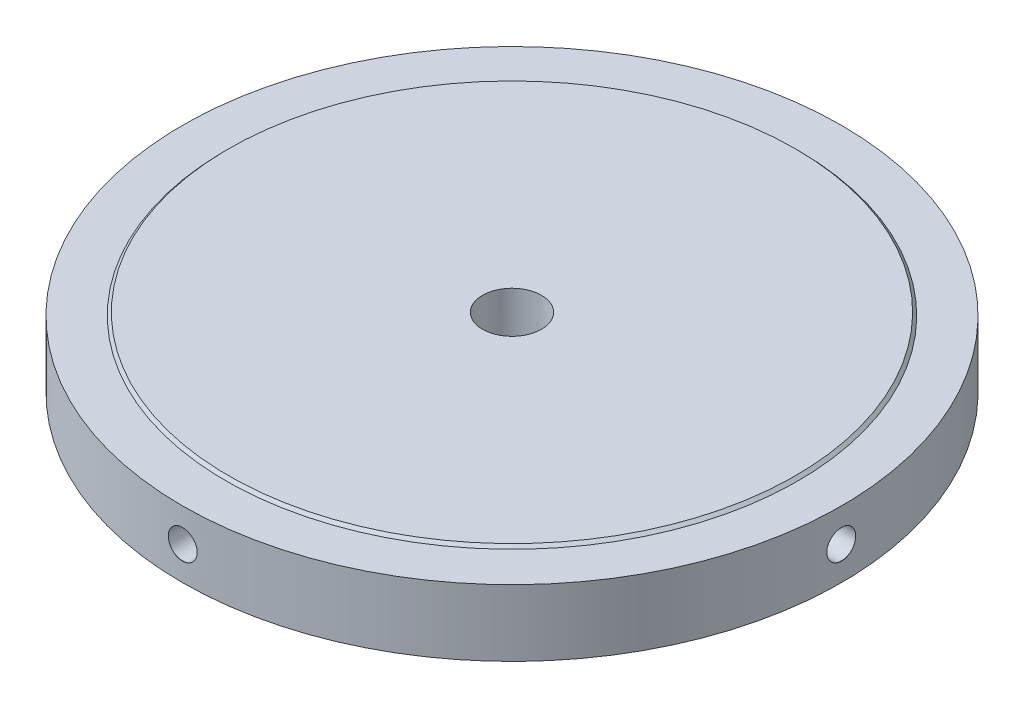
from build123d import *

# Parameters (mm, degrees)
F_5_0MM_DOWEL_HOLE1_D                     = 5
F_5_0MM_DOWEL_HOLE1_DEPTH                 = 12
F_5_0MM_DOWEL_HOLE1_CSINK_D               = 5.05
F_5_0MM_DOWEL_HOLE1_CSINK_ANGLE           = 90
F_5_0MM_DOWEL_HOLE1_TIP                   = 1.502151548
F_5_0MM_DOWEL_HOLE1_ON_FACE_2_D           = 5
F_5_0MM_DOWEL_HOLE1_ON_FACE_2_DEPTH       = 12
F_5_0MM_DOWEL_HOLE1_ON_FACE_2_CSINK_D     = 5.05
F_5_0MM_DOWEL_HOLE1_ON_FACE_2_CSINK_ANGLE = 90
F_5_0MM_DOWEL_HOLE1_ON_FACE_2_TIP         = 1.502151548
F_5_0MM_DOWEL_HOLE1_ON_FACE_3_D           = 5
F_5_0MM_DOWEL_HOLE1_ON_FACE_3_DEPTH       = 12
F_5_0MM_DOWEL_HOLE1_ON_FACE_3_CSINK_D     = 5.05
F_5_0MM_DOWEL_HOLE1_ON_FACE_3_CSINK_ANGLE = 90
F_5_0MM_DOWEL_HOLE1_ON_FACE_3_TIP         = 1.502151548
F_5_0MM_DOWEL_HOLE1_ON_FACE_4_D           = 5
F_5_0MM_DOWEL_HOLE1_ON_FACE_4_DEPTH       = 12
F_5_0MM_DOWEL_HOLE1_ON_FACE_4_CSINK_D     = 5.05
F_5_0MM_DOWEL_HOLE1_ON_FACE_4_CSINK_ANGLE = 90
F_5_0MM_DOWEL_HOLE1_ON_FACE_4_TIP         = 1.502151548
M12_TAPPED_HOLE1_D                        = 10.2


with BuildPart() as part:
    # Sketch1 → Revolve1 (revolve)
    with BuildSketch(Plane.XY, mode=Mode.PRIVATE) as revolve1_sk:
        Polygon((0, 6.25), (49, 6.25), (49.5, 5.75), (57, 5.75), (57, -5.75), (0, -5.75), align=None)
    revolve(revolve1_sk.sketch.rotate(Axis((0, 0, 0), (0, 1, 0)), 90), axis=Axis((0, 0, 0), (0, 1, 0)))

    # Ø5.0mm Dowel Hole1
    with Locations(Plane(origin=(57, 0, 0), x_dir=(0, 0, 1), z_dir=(1, 0, 0))):
        with Locations((0, 0)):
            CounterSinkHole(F_5_0MM_DOWEL_HOLE1_D / 2, F_5_0MM_DOWEL_HOLE1_CSINK_D / 2, depth=F_5_0MM_DOWEL_HOLE1_DEPTH, counter_sink_angle=F_5_0MM_DOWEL_HOLE1_CSINK_ANGLE)
            with Locations((0, 0, -(F_5_0MM_DOWEL_HOLE1_DEPTH + F_5_0MM_DOWEL_HOLE1_TIP / 2))):  # 118° drill point
                Cone(0, F_5_0MM_DOWEL_HOLE1_D / 2, F_5_0MM_DOWEL_HOLE1_TIP, mode=Mode.SUBTRACT)

    # Ø5.0mm Dowel Hole1 on face 2
    with Locations(Plane.XY.offset(57)):
        with Locations((0, 0)):
            CounterSinkHole(F_5_0MM_DOWEL_HOLE1_ON_FACE_2_D / 2, F_5_0MM_DOWEL_HOLE1_ON_FACE_2_CSINK_D / 2, depth=F_5_0MM_DOWEL_HOLE1_ON_FACE_2_DEPTH, counter_sink_angle=F_5_0MM_DOWEL_HOLE1_ON_FACE_2_CSINK_ANGLE)
            with Locations((0, 0, -(F_5_0MM_DOWEL_HOLE1_ON_FACE_2_DEPTH + F_5_0MM_DOWEL_HOLE1_ON_FACE_2_TIP / 2))):  # 118° drill point
                Cone(0, F_5_0MM_DOWEL_HOLE1_ON_FACE_2_D / 2, F_5_0MM_DOWEL_HOLE1_ON_FACE_2_TIP, mode=Mode.SUBTRACT)

    # Ø5.0mm Dowel Hole1 on face 3
    with Locations(Plane(origin=(-57, 0, 0), x_dir=(0, 0, -1), z_dir=(-1, 0, 0))):
        with Locations((0, 0)):
            CounterSinkHole(F_5_0MM_DOWEL_HOLE1_ON_FACE_3_D / 2, F_5_0MM_DOWEL_HOLE1_ON_FACE_3_CSINK_D / 2, depth=F_5_0MM_DOWEL_HOLE1_ON_FACE_3_DEPTH, counter_sink_angle=F_5_0MM_DOWEL_HOLE1_ON_FACE_3_CSINK_ANGLE)
            with Locations((0, 0, -(F_5_0MM_DOWEL_HOLE1_ON_FACE_3_DEPTH + F_5_0MM_DOWEL_HOLE1_ON_FACE_3_TIP / 2))):  # 118° drill point
                Cone(0, F_5_0MM_DOWEL_HOLE1_ON_FACE_3_D / 2, F_5_0MM_DOWEL_HOLE1_ON_FACE_3_TIP, mode=Mode.SUBTRACT)

    # Ø5.0mm Dowel Hole1 on face 4
    with Locations(Plane(origin=(0, 0, -57), x_dir=(-1, 0, 0), z_dir=(0, 0, -1))):
        with Locations((0, 0)):
            CounterSinkHole(F_5_0MM_DOWEL_HOLE1_ON_FACE_4_D / 2, F_5_0MM_DOWEL_HOLE1_ON_FACE_4_CSINK_D / 2, depth=F_5_0MM_DOWEL_HOLE1_ON_FACE_4_DEPTH, counter_sink_angle=F_5_0MM_DOWEL_HOLE1_ON_FACE_4_CSINK_ANGLE)
            with Locations((0, 0, -(F_5_0MM_DOWEL_HOLE1_ON_FACE_4_DEPTH + F_5_0MM_DOWEL_HOLE1_ON_FACE_4_TIP / 2))):  # 118° drill point
                Cone(0, F_5_0MM_DOWEL_HOLE1_ON_FACE_4_D / 2, F_5_0MM_DOWEL_HOLE1_ON_FACE_4_TIP, mode=Mode.SUBTRACT)

    # M12 Tapped Hole1 (through all)
    with Locations(Plane(origin=(0, 6.25, 0), x_dir=(1, 0, 0), z_dir=(0, 1, 0))):
        with Locations((0, 0)):
            Hole(M12_TAPPED_HOLE1_D / 2)


solid = part.part
